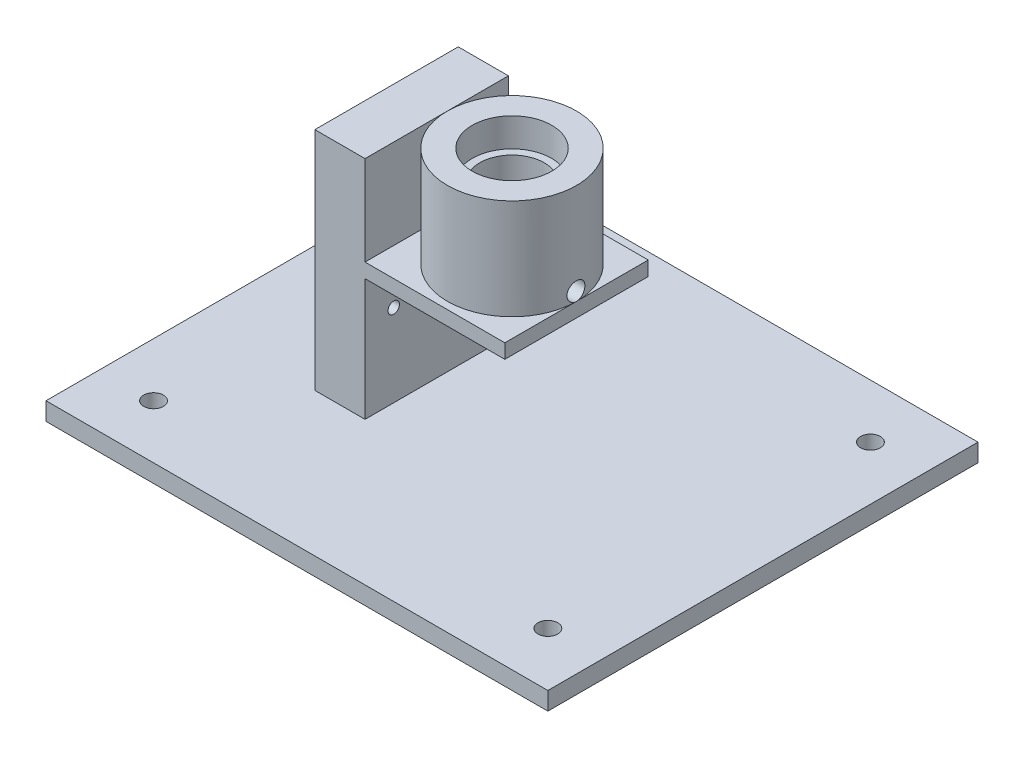
from build123d import *

# Parameters (mm, degrees)
BENCH_FOOTPRINT_140X120_PROFILE_W       = 140
BENCH_FOOTPRINT_140X120_PROFILE_H       = 120
BENCH_FOOTPRINT_140X120_DEPTH           = 5
BACKBONE_START                          = -20
BACKBONE_PROFILE_W                      = 14
BACKBONE_PROFILE_H                      = 63
BACKBONE_DEPTH                          = 40
REMOVABLE_SERVO_MOUNT_M3_START          = -40
REMOVABLE_SERVO_MOUNT_M3_PROFILE_R      = 1.6
REMOVABLE_SERVO_MOUNT_M3_DEPTH          = 155.560027933
BEARING_BRIDGE_START                    = 39
BEARING_BRIDGE_PROFILE_W                = 53
BEARING_BRIDGE_PROFILE_H                = 40
BEARING_BRIDGE_DEPTH                    = 4
BRIDGE_HORN_CLEARANCE_START             = 38
BRIDGE_HORN_CLEARANCE_PROFILE_R         = 14
BRIDGE_HORN_CLEARANCE_DEPTH             = 77.560027933
DRIVE_COLLAR_CHAMBER_START              = 43
DRIVE_COLLAR_CHAMBER_PROFILE_R          = 18
DRIVE_COLLAR_CHAMBER_PROFILE_R_2        = 14
DRIVE_COLLAR_CHAMBER_DEPTH              = 5
BEARING_TOWER_START                     = 48
BEARING_TOWER_PROFILE_R                 = 18
BEARING_TOWER_PROFILE_R_2               = 11.1
BEARING_TOWER_DEPTH                     = 23
BEARING_SEPARATION_SHOULDER_START       = 55
BEARING_SEPARATION_SHOULDER_PROFILE_R   = 11.1
BEARING_SEPARATION_SHOULDER_PROFILE_R_2 = 9
BEARING_SEPARATION_SHOULDER_DEPTH       = 8
BENCH_CLAMP_HOLES_START                 = -1
BENCH_CLAMP_HOLES_PROFILE_R             = 2.75
BENCH_CLAMP_HOLES_DEPTH                 = 118.365802537
YAW_CROSSBOLT_ACCESS_START              = -40
YAW_CROSSBOLT_ACCESS_PROFILE_R          = 2.5
YAW_CROSSBOLT_ACCESS_DEPTH              = 157.365802537


with BuildPart() as part:
    # Bench_footprint_140x120_profile → Bench_footprint_140x120 (new body)
    with BuildSketch(Plane(origin=(0, 0, 0), x_dir=(1, 0, 0), z_dir=(0, 1, 0))):
        Rectangle(BENCH_FOOTPRINT_140X120_PROFILE_W, BENCH_FOOTPRINT_140X120_PROFILE_H)
    extrude(amount=BENCH_FOOTPRINT_140X120_DEPTH)

    # Backbone_profile → Backbone (add)
    with BuildSketch(Plane.XY.offset(BACKBONE_START)):
        with Locations((-28, 36.5)):
            Rectangle(BACKBONE_PROFILE_W, BACKBONE_PROFILE_H)
    extrude(amount=BACKBONE_DEPTH)

    # Removable_servo_mount_M3_profile → Removable_servo_mount_M3 (cut, through all)
    with BuildSketch(Plane(origin=(0, 0, 0), x_dir=(0, 0, -1), z_dir=(1, 0, 0)).offset(REMOVABLE_SERVO_MOUNT_M3_START)):
        with Locations(Location((12, 28, 0), (0, 0, 180))):
            Circle(REMOVABLE_SERVO_MOUNT_M3_PROFILE_R)
        with Locations(Location((-12, 28, 0), (0, 0, 180))):
            Circle(REMOVABLE_SERVO_MOUNT_M3_PROFILE_R)
    extrude(amount=REMOVABLE_SERVO_MOUNT_M3_DEPTH, mode=Mode.SUBTRACT)

    # Bearing_bridge_profile → Bearing_bridge (add)
    with BuildSketch(Plane(origin=(0, 0, 0), x_dir=(1, 0, 0), z_dir=(0, 1, 0)).offset(BEARING_BRIDGE_START)):
        with Locations((-8.5, 0)):
            Rectangle(BEARING_BRIDGE_PROFILE_W, BEARING_BRIDGE_PROFILE_H)
    extrude(amount=BEARING_BRIDGE_DEPTH)

    # Bridge_horn_clearance_profile → Bridge_horn_clearance (cut, through all)
    with BuildSketch(Plane(origin=(0, 0, 0), x_dir=(1, 0, 0), z_dir=(0, 1, 0)).offset(BRIDGE_HORN_CLEARANCE_START)):
        with Locations(Location((0, 0, 0), (0, 0, 90))):
            Circle(BRIDGE_HORN_CLEARANCE_PROFILE_R)
    extrude(amount=BRIDGE_HORN_CLEARANCE_DEPTH, mode=Mode.SUBTRACT)

    # Drive_collar_chamber_profile → Drive_collar_chamber (add)
    with BuildSketch(Plane(origin=(0, 0, 0), x_dir=(1, 0, 0), z_dir=(0, 1, 0)).offset(DRIVE_COLLAR_CHAMBER_START)):
        Circle(DRIVE_COLLAR_CHAMBER_PROFILE_R)
        with Locations(Location((0, 0, 0), (0, 0, 90))):
            Circle(DRIVE_COLLAR_CHAMBER_PROFILE_R_2, mode=Mode.SUBTRACT)
    extrude(amount=DRIVE_COLLAR_CHAMBER_DEPTH)

    # Bearing_tower_profile → Bearing_tower (add)
    with BuildSketch(Plane(origin=(0, 0, 0), x_dir=(1, 0, 0), z_dir=(0, 1, 0)).offset(BEARING_TOWER_START)):
        Circle(BEARING_TOWER_PROFILE_R)
        with Locations(Location((0, 0, 0), (0, 0, 270))):
            Circle(BEARING_TOWER_PROFILE_R_2, mode=Mode.SUBTRACT)
    extrude(amount=BEARING_TOWER_DEPTH)

    # Bearing_separation_shoulder_profile → Bearing_separation_shoulder (add)
    with BuildSketch(Plane(origin=(0, 0, 0), x_dir=(1, 0, 0), z_dir=(0, 1, 0)).offset(BEARING_SEPARATION_SHOULDER_START)):
        with Locations(Location((0, 0, 0), (0, 0, 270))):
            Circle(BEARING_SEPARATION_SHOULDER_PROFILE_R)
        with Locations(Location((0, 0, 0), (0, 0, 270))):
            Circle(BEARING_SEPARATION_SHOULDER_PROFILE_R_2, mode=Mode.SUBTRACT)
    extrude(amount=BEARING_SEPARATION_SHOULDER_DEPTH)

    # Bench_clamp_holes_profile → Bench_clamp_holes (cut, through all)
    with BuildSketch(Plane(origin=(0, 0, 0), x_dir=(1, 0, 0), z_dir=(0, 1, 0)).offset(BENCH_CLAMP_HOLES_START)):
        with Locations(Location((-55, -45, 0), (0, 0, 90))):
            Circle(BENCH_CLAMP_HOLES_PROFILE_R)
        with Locations(Location((55, -45, 0), (0, 0, 90))):
            Circle(BENCH_CLAMP_HOLES_PROFILE_R)
        with Locations(Location((-55, 45, 0), (0, 0, 90))):
            Circle(BENCH_CLAMP_HOLES_PROFILE_R)
        with Locations(Location((55, 45, 0), (0, 0, 90))):
            Circle(BENCH_CLAMP_HOLES_PROFILE_R)
    extrude(amount=BENCH_CLAMP_HOLES_DEPTH, mode=Mode.SUBTRACT)

    # Yaw_crossbolt_access_profile → Yaw_crossbolt_access (cut, through all)
    with BuildSketch(Plane(origin=(0, 0, 0), x_dir=(0, 0, -1), z_dir=(1, 0, 0)).offset(YAW_CROSSBOLT_ACCESS_START)):
        with Locations(Location((0, 45.5, 0), (0, 0, 90))):
            Circle(YAW_CROSSBOLT_ACCESS_PROFILE_R)
    extrude(amount=YAW_CROSSBOLT_ACCESS_DEPTH, mode=Mode.SUBTRACT)


solid = part.part
